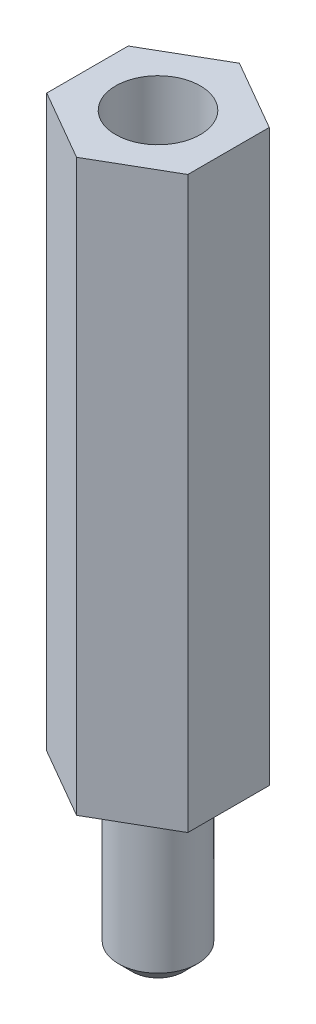
from build123d import *

# Parameters (mm, degrees)
EXTRUDE_1_DEPTH     = 20.2
SKETCH_2_R          = 1.4
EXTRUDE_2_DEPTH     = 5.8
CHAMFER_1_SIZE      = 0.5
SKETCH_3_R          = 1.5
CUT_EXTRUDE_1_DEPTH = 7


with BuildPart() as part:
    # Эскиз1 → Бобышка-Вытянуть1 (new body)
    with BuildSketch(Plane(origin=(0, 0, 0), x_dir=(1, 0, 0), z_dir=(0, 1, 0))):
        Polygon((0, 2.886751346), (-2.5, 1.443375673), (-2.5, -1.443375673), (0, -2.886751346), (2.5, -1.443375673), (2.5, 1.443375673), align=None)
    extrude(amount=EXTRUDE_1_DEPTH)

    # Эскиз2 → Бобышка-Вытянуть2 (add)
    with BuildSketch(Plane.XZ):
        with Locations(Location((0, 0, 0), (0, 0, 270))):
            Circle(SKETCH_2_R)
    extrude(amount=EXTRUDE_2_DEPTH)

    # Фаска1
    chamfer_1_edges = [part.edges().sort_by_distance(p)[0] for p in [
        (0, -5.8, 1.4),
    ]]
    chamfer(chamfer_1_edges, length=CHAMFER_1_SIZE)

    # Эскиз3 → Вырез-Вытянуть1 (cut)
    with BuildSketch(Plane(origin=(0, 20.2, 0), x_dir=(1, 0, 0), z_dir=(0, 1, 0))):
        with Locations(Location((0, 0, 0), (0, 0, 270))):
            Circle(SKETCH_3_R)
    extrude(amount=-CUT_EXTRUDE_1_DEPTH, mode=Mode.SUBTRACT)


solid = part.part
